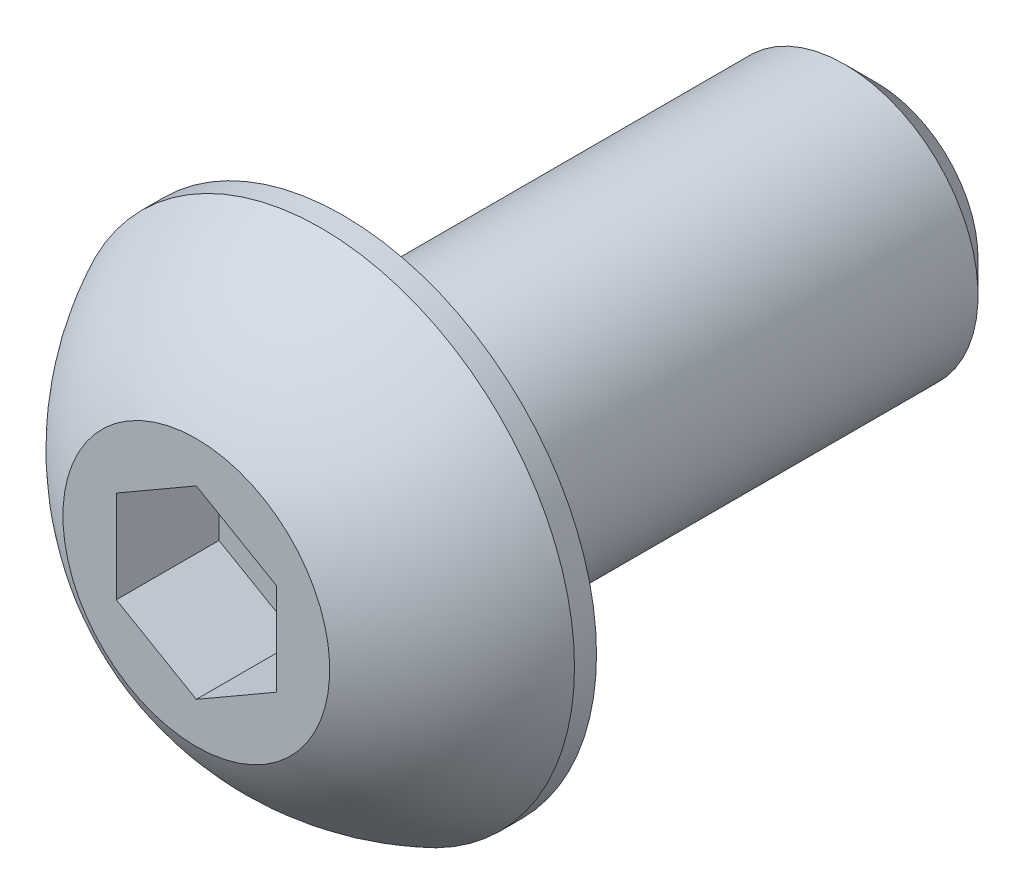
from build123d import *

# Parameters (mm, degrees)
SKETCH1_W          = 10
SKETCH1_H          = 2.5
CHAMFER1_SIZE      = 0.6
CUT_EXTRUDE2_DEPTH = 1.925


with BuildPart() as part:
    # Sketch1 → Revolve1 (revolve)
    with BuildSketch(Plane(origin=(0, 0, 0), x_dir=(0, 0, -1), z_dir=(1, 0, 0))):
        with Locations((7.75, 1.25)):
            Rectangle(SKETCH1_W, SKETCH1_H)
    revolve(axis=Axis((0, 0, -12.75), (0, 0, 1)))

    # Chamfer1
    chamfer1_edges = [part.edges().sort_by_distance(p)[0] for p in [
        (0, -2.5, -12.75),
    ]]
    chamfer(chamfer1_edges, length=CHAMFER1_SIZE)

    # Sketch7 → Revolve2 (revolve)
    with BuildSketch(Plane(origin=(0, 0, 0), x_dir=(0, 0, -1), z_dir=(1, 0, 0))):
        with BuildLine():
            Line((2.3375, 4.75), (2.75, 4.75))
            Line((2.75, 4.75), (2.75, 0))
            Line((2.75, 0), (0, 0))
            Line((0, 0), (0, 2.5))
            ThreePointArc((0, 2.5), (0.991875183, 3.808753282), (2.3375, 4.75))
        make_face()
    revolve(axis=Axis((0, 0, 0), (0, 0, -1)))

    # Sketch5 → Cut-Extrude2 (cut)
    with BuildSketch(Plane.XY):
        Polygon((1.5, -0.866025404), (1.5, 0.866025404), (0, 1.732050808), (-1.5, 0.866025404), (-1.5, -0.866025404), (0, -1.732050808), align=None)
    extrude(amount=-CUT_EXTRUDE2_DEPTH, mode=Mode.SUBTRACT)


solid = part.part
